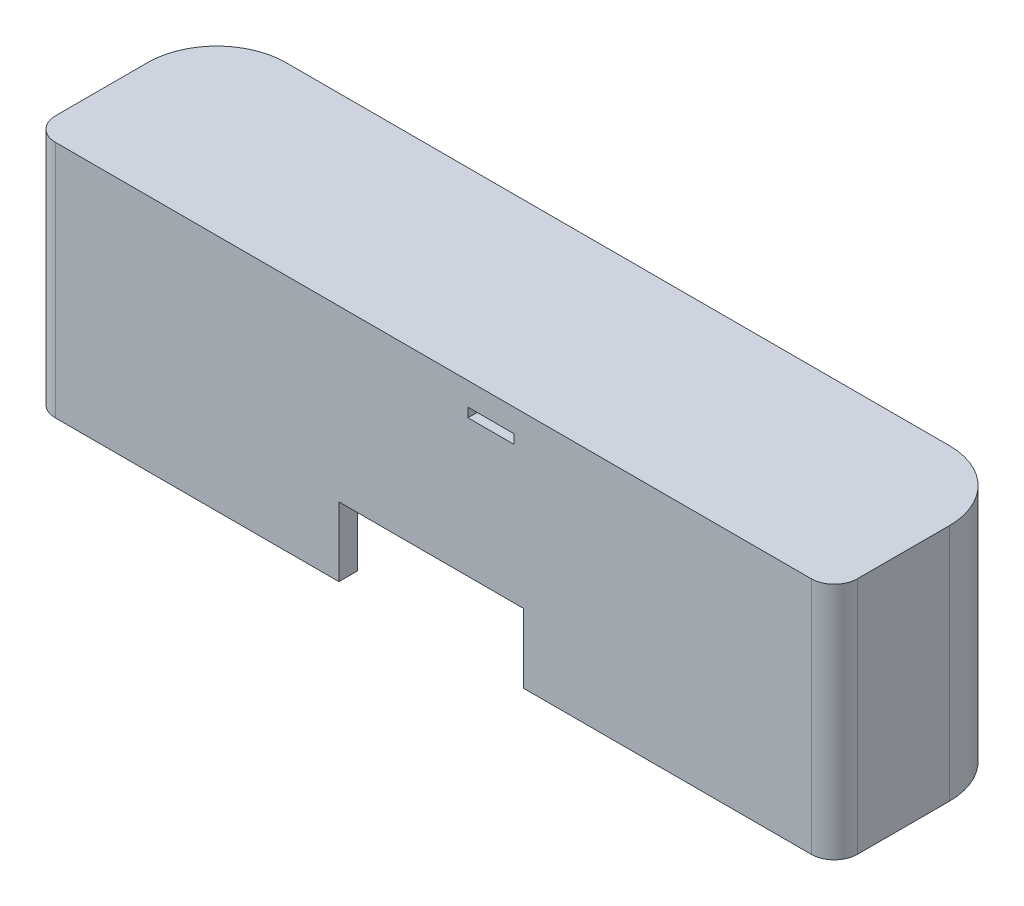
from build123d import *

# Parameters (mm, degrees)
BOSS_EXTRUDE1_DEPTH = 46.8
SKETCH5_W           = 40
SKETCH5_H           = 15
CUT_EXTRUDE1_DEPTH  = 4
BOSS_EXTRUDE3_DEPTH = 5
SKETCH13_W          = 10
SKETCH13_H          = 2
CUT_EXTRUDE2_DEPTH  = 37


with BuildPart() as part:
    # Sketch1 → Boss-Extrude1 (new body)
    with BuildSketch(Plane(origin=(0, 0, 0), x_dir=(1, 0, 0), z_dir=(0, 1, 0))):
        with BuildLine():
            Line((-82, -20), (82, -20))
            ThreePointArc((82, -20), (85.535533906, -18.535533906), (87, -15))
            Line((87, -15), (87, 5))
            ThreePointArc((87, 5), (82.606601718, 15.606601718), (72, 20))
            Line((72, 20), (-72, 20))
            ThreePointArc((-72, 20), (-82.606601718, 15.606601718), (-87, 5))
            Line((-87, 5), (-87, -15))
            ThreePointArc((-87, -15), (-85.535533906, -18.535533906), (-82, -20))
        make_face()
        with BuildLine():
            Line((-68.08, 16), (68.08, 16))
            add(Edge.make_bspline(
                [(83, 2.5), (83, 16), (68.08, 16)],
                knots=[0, 0, 0, 1.570796327, 1.570796327, 1.570796327], degree=2, weights=[1, 0.707106781, 1]))
            Line((83, 2.5), (83, -16))
            Line((83, -16), (-83, -16))
            Line((-83, -16), (-83, 2.5))
            add(Edge.make_bspline(
                [(-68.08, 16), (-83, 16), (-83, 2.5)],
                knots=[4.71238898, 4.71238898, 4.71238898, 6.283185307, 6.283185307, 6.283185307], degree=2, weights=[1, 0.707106781, 1]))
        make_face(mode=Mode.SUBTRACT)
    extrude(amount=BOSS_EXTRUDE1_DEPTH)

    # Sketch5 → Cut-Extrude1 (cut)
    with BuildSketch(Plane.XY.offset(20)):
        with Locations((-0.5, 7.5)):
            Rectangle(SKETCH5_W, SKETCH5_H)
    extrude(amount=-CUT_EXTRUDE1_DEPTH, mode=Mode.SUBTRACT)

    # Sketch10 → Boss-Extrude3 (add)
    with BuildSketch(Plane(origin=(0, 46.8, 0), x_dir=(1, 0, 0), z_dir=(0, 1, 0))):
        with BuildLine():
            Line((-82, -20), (82, -20))
            ThreePointArc((82, -20), (85.535533906, -18.535533906), (87, -15))
            Line((87, -15), (87, 5))
            ThreePointArc((87, 5), (82.606601718, 15.606601718), (72, 20))
            Line((72, 20), (-72, 20))
            ThreePointArc((-72, 20), (-82.606601718, 15.606601718), (-87, 5))
            Line((-87, 5), (-87, -15))
            ThreePointArc((-87, -15), (-85.535533906, -18.535533906), (-82, -20))
        make_face()
    extrude(amount=BOSS_EXTRUDE3_DEPTH)

    # Sketch13 → Cut-Extrude2 (cut)
    with BuildSketch(Plane.XY.offset(20)):
        with Locations((12.5, 45.8)):
            Rectangle(SKETCH13_W, SKETCH13_H)
    extrude(amount=-CUT_EXTRUDE2_DEPTH, mode=Mode.SUBTRACT)


solid = part.part
